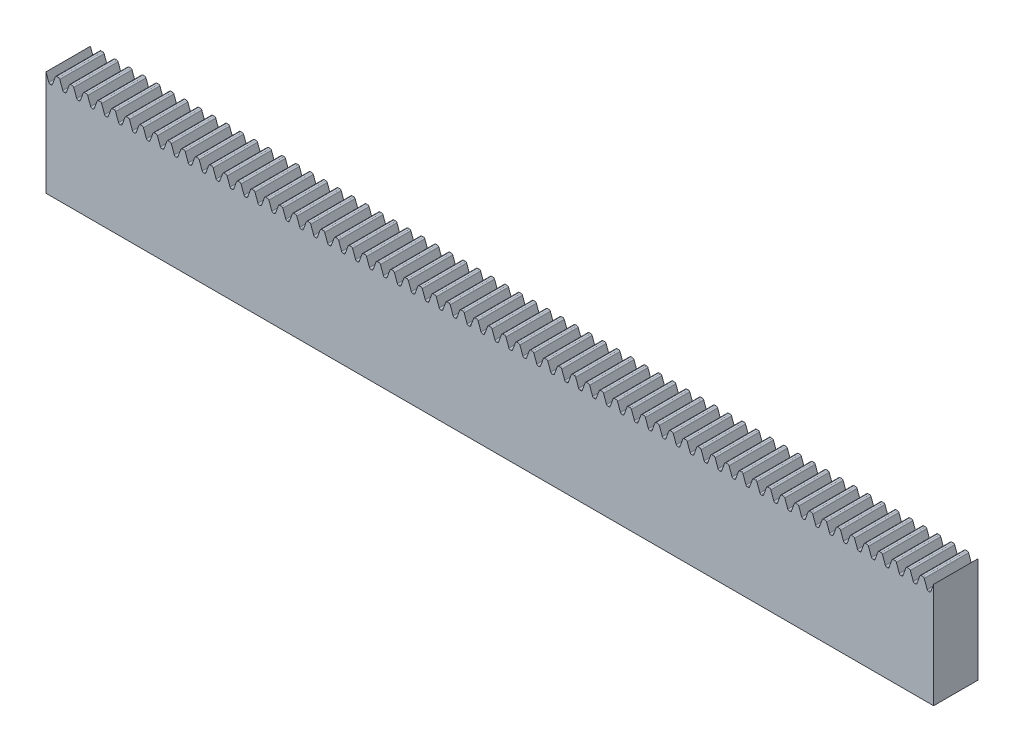
from build123d import *

# Parameters (mm, degrees)
BOSS_EXTRUDE1_DEPTH      = 2.5
BOSS_EXTRUDE1_DEPTH_BACK = 2.5
SKETCH3_W                = 100
SKETCH3_H                = 12
CUT_EXTRUDE1_DEPTH       = 51.420729864
LPATTERN1_COUNT          = 64
LPATTERN1_PITCH          = 1.570796327
LPATTERN1_COL_COUNT      = 2
LPATTERN1_COL_PITCH      = 1.570796327


with BuildPart() as part:
    # Sketch3 → Boss-Extrude1 (new, two sides: drawn at the far end of the back side and taken through both)
    with BuildSketch(Plane.XY.offset(-BOSS_EXTRUDE1_DEPTH_BACK)):
        Rectangle(SKETCH3_W, SKETCH3_H)
    extrude(amount=BOSS_EXTRUDE1_DEPTH + BOSS_EXTRUDE1_DEPTH_BACK)

    # Sketch4 → Cut-Extrude1 (cut, symmetric)
    with BuildSketch(Plane.XY):
        with BuildLine():
            Line((-48.945574321, 5.889622222), (-48.905400095, 6))
            Line((-48.905400095, 6), (-49.480084294, 6))
            Line((-49.480084294, 6), (-49.480084294, 4.875))
            Line((-49.480084294, 4.875), (-49.432328186, 4.875))
            ThreePointArc((-49.432328186, 4.875), (-49.336109295, 4.9053377), (-49.274692383, 4.985377778))
            Line((-49.274692383, 4.985377778), (-48.945574321, 5.889622222))
        make_face()
        with BuildLine():
            Line((-48.787938518, 6), (-48.905400095, 6))
            Line((-48.905400095, 6), (-48.945574321, 5.889622222))
            ThreePointArc((-48.945574321, 5.889622222), (-48.884157409, 5.9696623), (-48.787938518, 6))
        make_face()
        with BuildLine():
            Line((-48.44379794, 5.889622222), (-48.483972166, 6))
            Line((-48.483972166, 6), (-48.601433744, 6))
            ThreePointArc((-48.601433744, 6), (-48.505214852, 5.9696623), (-48.44379794, 5.889622222))
        make_face()
        with BuildLine():
            Line((-47.909287967, 4.875), (-47.909287967, 6))
            Line((-47.909287967, 6), (-48.483972166, 6))
            Line((-48.483972166, 6), (-48.44379794, 5.889622222))
            Line((-48.44379794, 5.889622222), (-48.114679878, 4.985377778))
            ThreePointArc((-48.114679878, 4.985377778), (-48.053262966, 4.9053377), (-47.957044075, 4.875))
            Line((-47.957044075, 4.875), (-47.909287967, 4.875))
        make_face()
    cut_extrude1 = extrude(amount=CUT_EXTRUDE1_DEPTH, both=True, mode=Mode.SUBTRACT)

    # LPattern1: Cut-Extrude1 ×64
    with Locations(*[(i * LPATTERN1_PITCH, 0, 0) for i in range(1, LPATTERN1_COUNT)]):
        add(cut_extrude1, mode=Mode.SUBTRACT)

    # LPattern1 col: Cut-Extrude1 ×2
    with Locations(*[(-i * LPATTERN1_COL_PITCH, 0, 0) for i in range(1, LPATTERN1_COL_COUNT)]):
        add(cut_extrude1, mode=Mode.SUBTRACT)


solid = part.part
